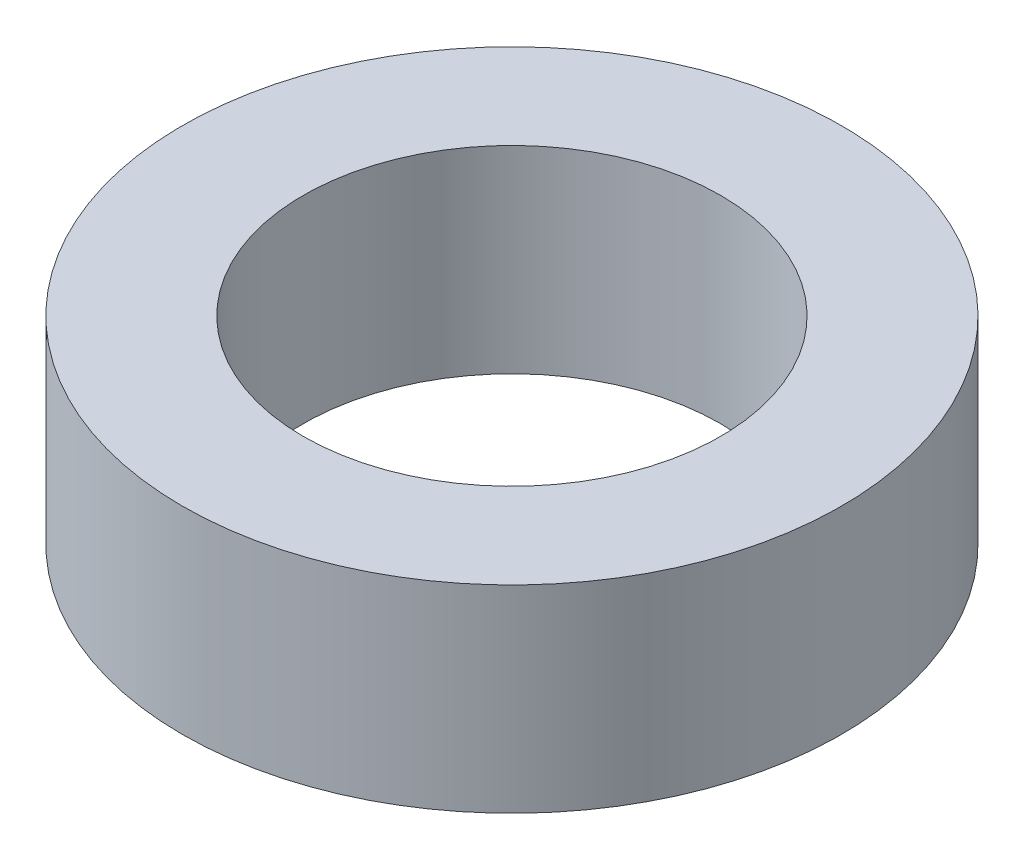
from build123d import *

# Parameters (mm, degrees)
SKETCH1_R           = 15
BOSS_EXTRUDE1_DEPTH = 9
SKETCH5_R           = 9.5
CUT_EXTRUDE3_DEPTH  = 24.043437244


with BuildPart() as part:
    # Sketch1 → Boss-Extrude1 (new body)
    with BuildSketch(Plane(origin=(0, 0, 0), x_dir=(1, 0, 0), z_dir=(0, 1, 0))):
        with Locations(Location((0, 0, 0), (0, 0, 270))):
            Circle(SKETCH1_R)
    extrude(amount=BOSS_EXTRUDE1_DEPTH)

    # Sketch5 → Cut-Extrude3 (cut, through all)
    with BuildSketch(Plane(origin=(0, 9, 0), x_dir=(1, 0, 0), z_dir=(0, 1, 0))):
        with Locations(Location((0, 0, 0), (0, 0, 270))):
            Circle(SKETCH5_R)
    extrude(amount=-CUT_EXTRUDE3_DEPTH, mode=Mode.SUBTRACT)


solid = part.part
